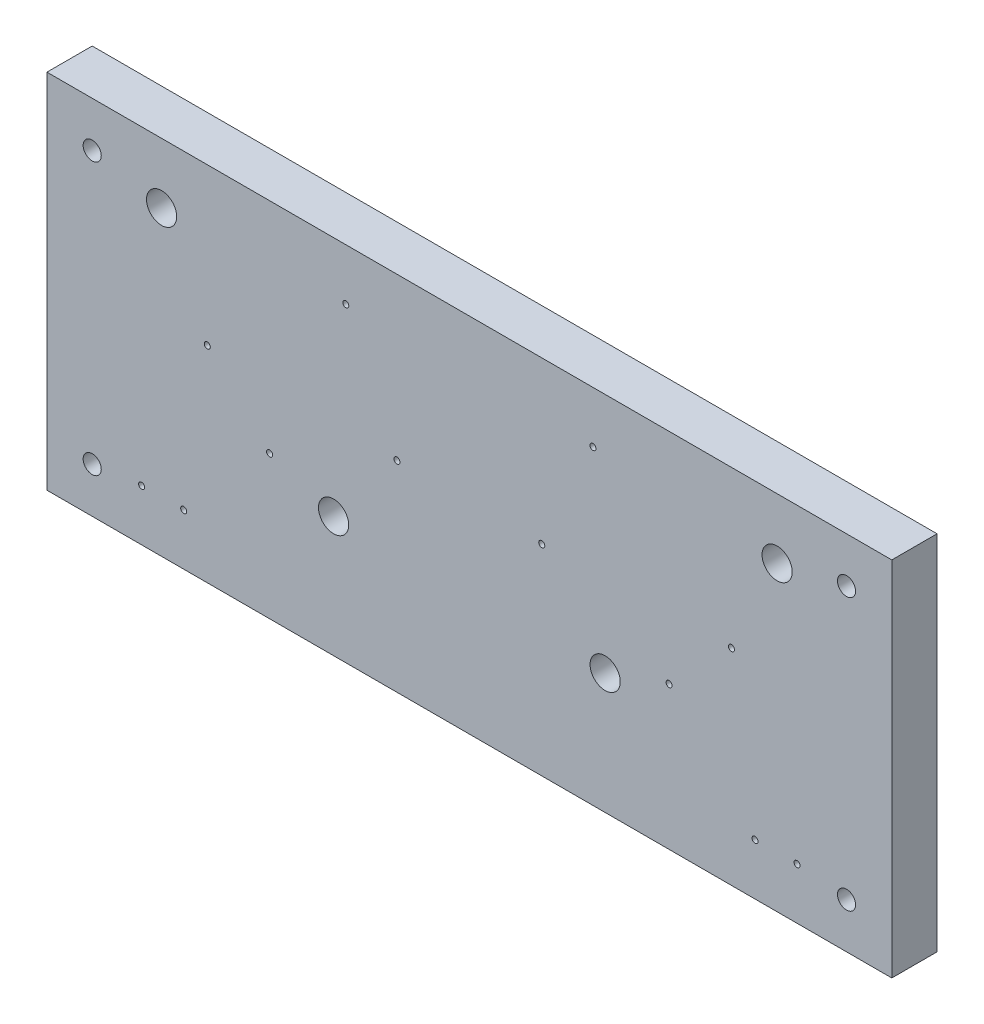
from build123d import *

# Parameters (mm, degrees)
SKETCH1_W           = 280
SKETCH1_H           = 120
SKETCH1_R           = 3
BOSS_EXTRUDE1_DEPTH = 15
SKETCH2_R           = 5
SKETCH2_R_2         = 1
CUT_EXTRUDE1_DEPTH  = 30


with BuildPart() as part:
    # Sketch1 → Boss-Extrude1 (new body)
    with BuildSketch(Plane.XY):
        Rectangle(SKETCH1_W, SKETCH1_H)
        with Locations((-125, 45)):
            Circle(SKETCH1_R, mode=Mode.SUBTRACT)
        with Locations((125, 45)):
            Circle(SKETCH1_R, mode=Mode.SUBTRACT)
        with Locations((125, -45)):
            Circle(SKETCH1_R, mode=Mode.SUBTRACT)
        with Locations((-125, -45)):
            Circle(SKETCH1_R, mode=Mode.SUBTRACT)
    extrude(amount=BOSS_EXTRUDE1_DEPTH)

    # Sketch2 → Cut-Extrude1 (cut)
    with BuildSketch(Plane.XY.offset(15)):
        with Locations((102, 40)):
            Circle(SKETCH2_R)
        with Locations((45, -20)):
            Circle(SKETCH2_R)
        with Locations((-45, -20)):
            Circle(SKETCH2_R)
        with Locations((-102, 40)):
            Circle(SKETCH2_R)
        with Locations(Location((108.600249206, -43, 0), (0, 0, 180))):
            Circle(SKETCH2_R_2)
        with Locations((94.663331879, -43)):
            Circle(SKETCH2_R_2)
        with Locations((86.854067304, 8.142611191)):
            Circle(SKETCH2_R_2)
        with Locations((66.197255592, -12.527826613)):
            Circle(SKETCH2_R_2)
        with Locations((23.991204862, 6.527590511)):
            Circle(SKETCH2_R_2)
        with Locations((40.954554728, 42.905606098)):
            Circle(SKETCH2_R_2)
        with Locations((-23.997872984, 6.527590511)):
            Circle(SKETCH2_R_2)
        with Locations((-40.96122285, 42.905606098)):
            Circle(SKETCH2_R_2)
        with Locations((-86.860735426, 8.142611191)):
            Circle(SKETCH2_R_2)
        with Locations((-66.203923713, -12.527826613)):
            Circle(SKETCH2_R_2)
        with Locations((-108.606917327, -43)):
            Circle(SKETCH2_R_2)
        with Locations((-94.67, -43)):
            Circle(SKETCH2_R_2)
    extrude(amount=-CUT_EXTRUDE1_DEPTH, mode=Mode.SUBTRACT)


solid = part.part
